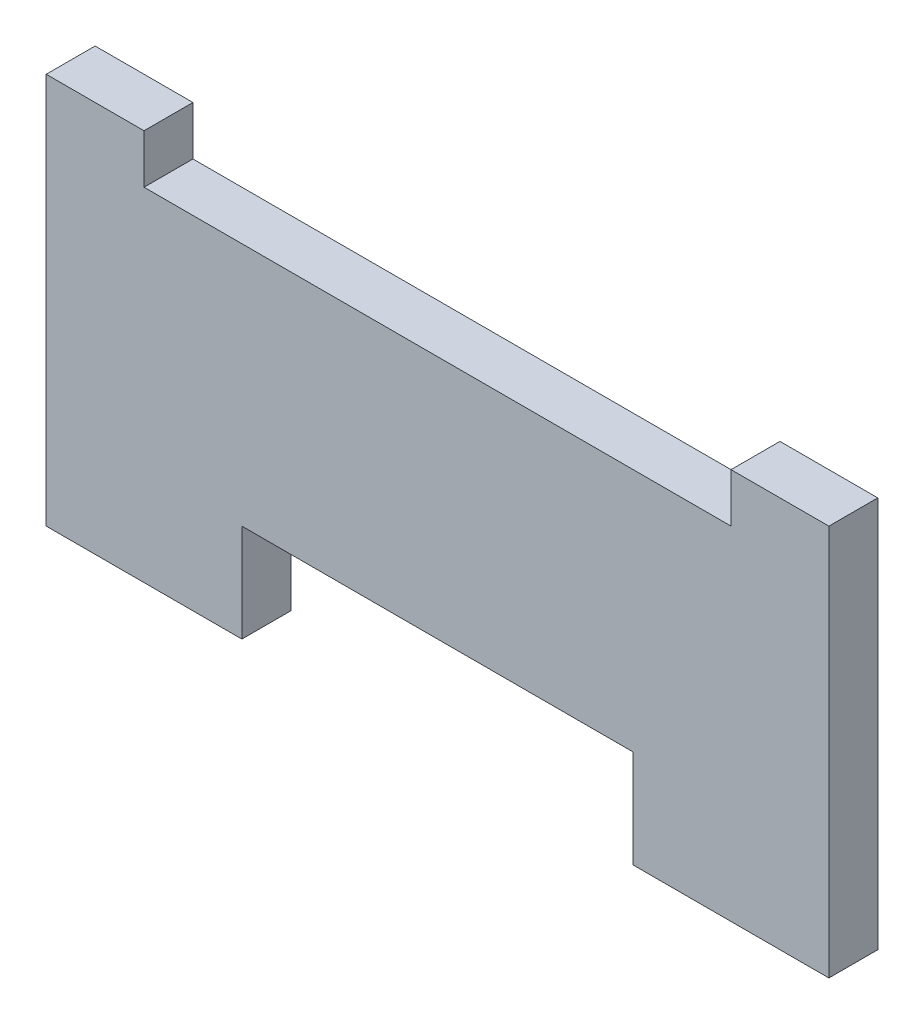
from build123d import *

# Parameters (mm, degrees)
CROQUIS1_W              = 8
CROQUIS1_H              = 4
SALIENTE_EXTRUIR1_DEPTH = 0.5
CROQUIS2_W              = 6
CROQUIS2_H              = 0.5
CROQUIS2_W_2            = 4
CROQUIS2_H_2            = 1
CORTAR_EXTRUIR1_DEPTH   = 0.5


with BuildPart() as part:
    # Croquis1 → Saliente-Extruir1 (new body)
    with BuildSketch(Plane.XY):
        with Locations((4, 2)):
            Rectangle(CROQUIS1_W, CROQUIS1_H)
    extrude(amount=SALIENTE_EXTRUIR1_DEPTH)

    # Croquis2 → Cortar-Extruir1 (cut)
    with BuildSketch(Plane.XY.offset(0.5)):
        with Locations((4, 3.75)):
            Rectangle(CROQUIS2_W, CROQUIS2_H)
        with Locations((4, 0.5)):
            Rectangle(CROQUIS2_W_2, CROQUIS2_H_2)
    extrude(amount=-CORTAR_EXTRUIR1_DEPTH, mode=Mode.SUBTRACT)


solid = part.part
